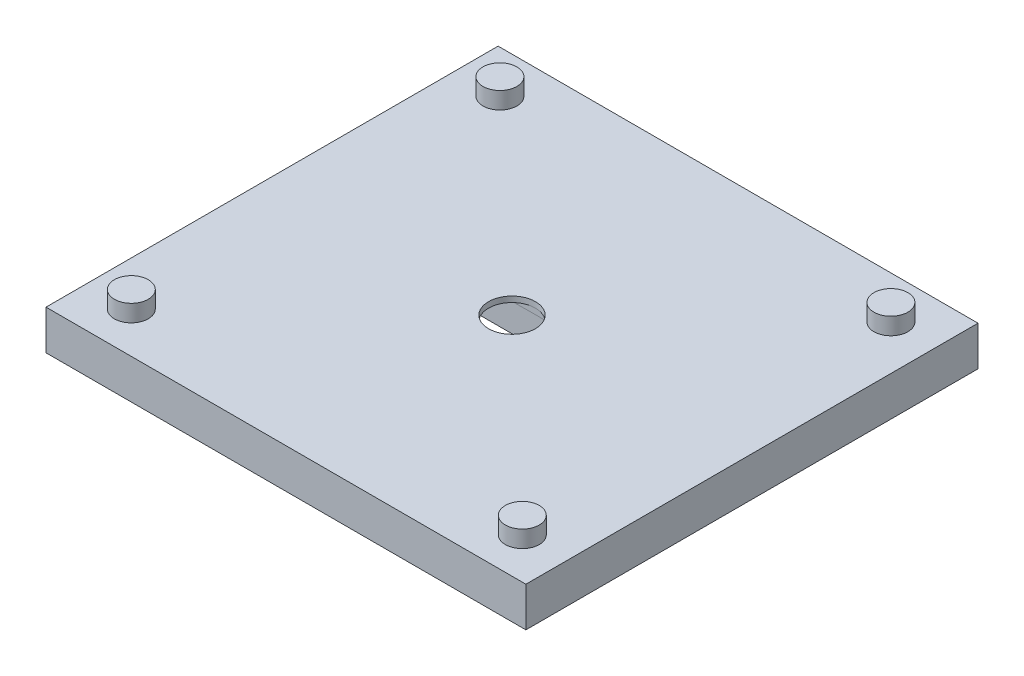
from build123d import *

# Parameters (mm, degrees)
SKETCH_4_W           = 84.916455131
SKETCH_4_H           = 80
SKETCH_4_R           = 3
EXTRUDE_1_DEPTH      = 7
EXTRUDE_2_DEPTH      = 3
EXTRUDE_2_DEPTH_BACK = 7
SKETCH_5_R           = 3
SKETCH_6_W           = 78
SKETCH_6_H           = 4.15
CUT_EXTRUDE_1_DEPTH  = 5
CUT_EXTRUDE_2_DEPTH  = 1
SKETCH_8_R           = 4.15
CUT_EXTRUDE_3_DEPTH  = 108.873135035


with BuildPart() as part:
    # 草图4 → 凸台-拉伸1 (new body)
    with BuildSketch(Plane(origin=(0, 0, 0), x_dir=(1, 0, 0), z_dir=(0, 1, 0))):
        with Locations((-1.967483917, -58.11712094)):
            Rectangle(SKETCH_4_W, SKETCH_4_H)
        with Locations(Location((-36.585071707, -25.636349073, 0), (0, 0, 270))):
            Circle(SKETCH_4_R, mode=Mode.SUBTRACT)
        with Locations(Location((32.601613083, -25.636349073, 0), (0, 0, 270))):
            Circle(SKETCH_4_R, mode=Mode.SUBTRACT)
        with Locations(Location((-36.585071707, -90.861964123, 0), (0, 0, 270))):
            Circle(SKETCH_4_R, mode=Mode.SUBTRACT)
        with Locations(Location((32.601613083, -90.861964123, 0), (0, 0, 270))):
            Circle(SKETCH_4_R, mode=Mode.SUBTRACT)
    extrude(amount=EXTRUDE_1_DEPTH)

    # 草图5 → 凸台-拉伸2 (add, two sides: drawn at the far end of the back side and taken through both)
    with BuildSketch(Plane(origin=(0, 7, 0), x_dir=(1, 0, 0), z_dir=(0, 1, 0)).offset(-EXTRUDE_2_DEPTH_BACK)):
        with Locations(Location((-36.585071707, -25.636349073, 0), (0, 0, 270))):
            Circle(SKETCH_5_R)
        with Locations(Location((32.601613083, -25.636349073, 0), (0, 0, 270))):
            Circle(SKETCH_5_R)
        with Locations(Location((-36.585071707, -90.861964123, 0), (0, 0, 270))):
            Circle(SKETCH_5_R)
        with Locations(Location((32.601613083, -90.861964123, 0), (0, 0, 270))):
            Circle(SKETCH_5_R)
    extrude(amount=EXTRUDE_2_DEPTH + EXTRUDE_2_DEPTH_BACK)

    # 草图6 → 切除-拉伸1 (cut)
    with BuildSketch(Plane.XZ):
        with Locations((-1.967483917, 60.19212094)):
            Rectangle(SKETCH_6_W, SKETCH_6_H)
        with Locations((-1.967483917, 56.04212094)):
            Rectangle(SKETCH_6_W, SKETCH_6_H)
    extrude(amount=-CUT_EXTRUDE_1_DEPTH, mode=Mode.SUBTRACT)

    # 草图7 → 切除-拉伸2 (cut)
    with BuildSketch(Plane.XZ.offset(-5)):
        with BuildLine():
            add(Edge.make_bspline(
                [(37.032516083, 58.11712094), (37.032516083, 62.26712094), (-1.967483917, 62.26712094), (-40.967483917, 62.26712094), (-40.967483917, 58.11712094)],
                knots=[3.141592654, 3.141592654, 3.141592654, 4.71238898, 4.71238898, 6.283185307, 6.283185307, 6.283185307], degree=2, weights=[1, 0.707106781, 1, 0.707106781, 1]))
            Line((-40.967483917, 58.11712094), (37.032516083, 58.11712094))
        make_face()
        with BuildLine():
            Line((37.032516083, 58.11712094), (-40.967483917, 58.11712094))
            add(Edge.make_bspline(
                [(-40.967483917, 58.11712094), (-40.967483917, 53.96712094), (-1.967483917, 53.96712094), (37.032516083, 53.96712094), (37.032516083, 58.11712094)],
                knots=[0, 0, 0, 1.570796327, 1.570796327, 3.141592654, 3.141592654, 3.141592654], degree=2, weights=[1, 0.707106781, 1, 0.707106781, 1]))
        make_face()
    extrude(amount=-CUT_EXTRUDE_2_DEPTH, mode=Mode.SUBTRACT)

    # 草图8 → 切除-拉伸3 (cut, through all)
    with BuildSketch(Plane.XZ.offset(-6)):
        with Locations(Location((-1.967483917, 58.11712094, 0), (0, 0, 270))):
            Circle(SKETCH_8_R)
    extrude(amount=-CUT_EXTRUDE_3_DEPTH, mode=Mode.SUBTRACT)


solid = part.part
